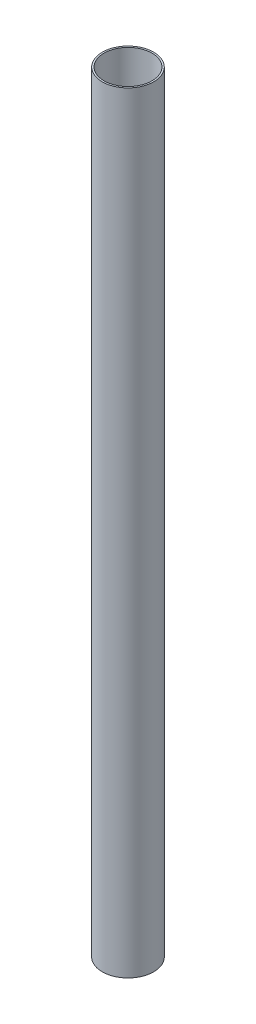
from build123d import *

# Parameters (mm, degrees)
SKETCH1_R           = 12.7
SKETCH1_R_2         = 11.8745
BOSS_EXTRUDE1_DEPTH = 381


with BuildPart() as part:
    # Sketch1 → Boss-Extrude1 (new body)
    with BuildSketch(Plane(origin=(0, 0, 0), x_dir=(1, 0, 0), z_dir=(0, 1, 0))):
        with Locations(Location((0, 0, 0), (0, 0, 270))):
            Circle(SKETCH1_R)
        with Locations(Location((0, 0, 0), (0, 0, 270))):
            Circle(SKETCH1_R_2, mode=Mode.SUBTRACT)
    extrude(amount=BOSS_EXTRUDE1_DEPTH)


solid = part.part
